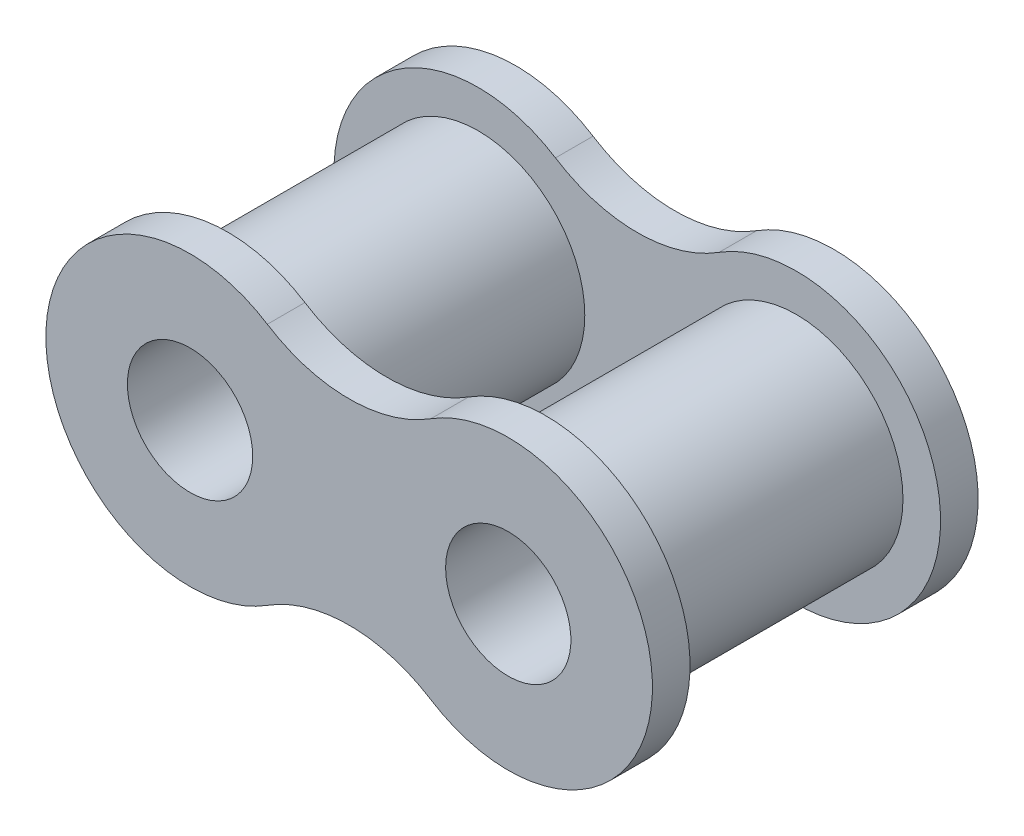
from build123d import *

# Parameters (mm, degrees)
SKETCH1_R               = 4.255
BOSS_EXTRUDE3_DEPTH     = 5
BOSS_EXTRUDE3_2_DEPTH   = 5
BOSS_EXTRUDE7_START     = -5
BOSS_EXTRUDE7_DEPTH     = 1.5
CUT_EXTRUDE1_DEPTH      = 15.896343511
CUT_EXTRUDE1_DEPTH_BACK = 15.896343511
SKETCH2_R               = 2.5


with BuildPart() as part:
    # Sketch1 → Boss-Extrude3 (new, symmetric)
    with BuildSketch(Plane.XY):
        with Locations((-6.35, 0)):
            Circle(SKETCH1_R)
    extrude(amount=BOSS_EXTRUDE3_DEPTH, both=True)



with BuildPart() as body_2:
    # Sketch1 → Boss-Extrude3 2 (new, symmetric)
    with BuildSketch(Plane.XY):
        with Locations((6.35, 0)):
            Circle(SKETCH1_R)
    extrude(amount=BOSS_EXTRUDE3_2_DEPTH, both=True)


with BuildPart() as part_1:
    add(part.part)

    add(body_2.part)  # Boss-Extrude7 merges body 2
    # Sketch1<5> → Boss-Extrude7 (add)
    with BuildSketch(Plane.XY.offset(BOSS_EXTRUDE7_START)):
        with BuildLine():
            ThreePointArc((-3.26499838, 4.858270268), (-12.105, 0), (-3.26499838, -4.858270268))
            ThreePointArc((-3.26499838, -4.858270268), (0, -3.909220161), (3.26499838, -4.858270268))
            ThreePointArc((3.26499838, -4.858270268), (12.105, 0), (3.26499838, 4.858270268))
            ThreePointArc((3.26499838, 4.858270268), (0, 3.909220161), (-3.26499838, 4.858270268))
        make_face()
    boss_extrude7 = extrude(amount=-BOSS_EXTRUDE7_DEPTH)

    # Mirror1: Boss-Extrude7 across plane
    add(boss_extrude7.mirror(Plane.XY))

    # Sketch2 → Cut-Extrude1 (cut, two sides: drawn at the far end of the back side and taken through both)
    with BuildSketch(Plane.XY.offset(-CUT_EXTRUDE1_DEPTH_BACK)):
        with Locations((-6.35, 0)):
            Circle(SKETCH2_R)
        with Locations((6.35, 0)):
            Circle(SKETCH2_R)
    extrude(amount=CUT_EXTRUDE1_DEPTH + CUT_EXTRUDE1_DEPTH_BACK, mode=Mode.SUBTRACT)


solid = part_1.part
